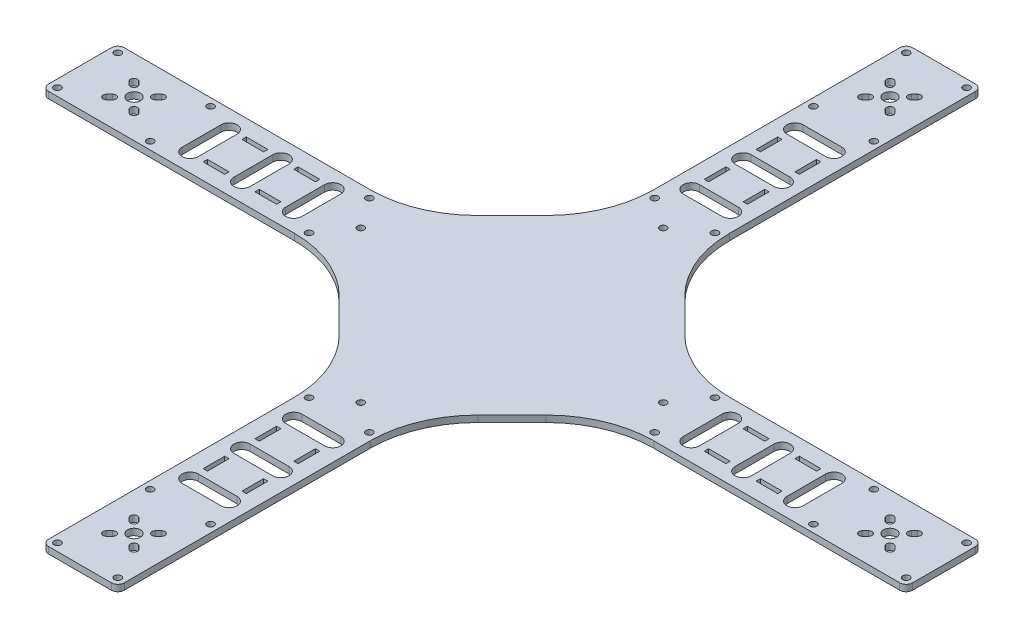
from build123d import *

# Parameters (mm, degrees)
SKETCH_196_R    = 1.6
SKETCH_196_W    = 10
SKETCH_196_H    = 2
SKETCH_196_R_2  = 3
SKETCH_196_W_2  = 2
SKETCH_196_H_2  = 10
EXTRUDE_1_DEPTH = 3
FILLET_3_R      = 3


with BuildPart() as part:
    # Sketch 196 → 凸台-拉伸1 (new body)
    with BuildSketch(Plane(origin=(0, 0, 0), x_dir=(1, 0, 0), z_dir=(0, 1, 0))):
        with BuildLine():
            Line((17.5, 25), (-17.5, 25))
            Line((-17.5, 25), (-17.5, -91.789321881))
            ThreePointArc((-17.5, -91.789321881), (-21.306023374, -110.9234935), (-32.144660941, -127.144660941))
            Line((-32.144660941, -127.144660941), (-47.855339059, -142.855339059))
            ThreePointArc((-47.855339059, -142.855339059), (-64.0765065, -153.693976626), (-83.210678119, -157.5))
            Line((-83.210678119, -157.5), (-200, -157.5))
            Line((-200, -157.5), (-200, -192.5))
            Line((-200, -192.5), (-83.210678119, -192.5))
            ThreePointArc((-83.210678119, -192.5), (-64.0765065, -196.306023374), (-47.855339059, -207.144660941))
            Line((-47.855339059, -207.144660941), (-32.144660941, -222.855339059))
            ThreePointArc((-32.144660941, -222.855339059), (-21.306023374, -239.0765065), (-17.5, -258.210678119))
            Line((-17.5, -258.210678119), (-17.5, -375))
            Line((-17.5, -375), (17.5, -375))
            Line((17.5, -375), (17.5, -258.210678119))
            ThreePointArc((17.5, -258.210678119), (21.306023374, -239.0765065), (32.144660941, -222.855339059))
            Line((32.144660941, -222.855339059), (47.855339059, -207.144660941))
            ThreePointArc((47.855339059, -207.144660941), (64.0765065, -196.306023374), (83.210678119, -192.5))
            Line((83.210678119, -192.5), (200, -192.5))
            Line((200, -192.5), (200, -157.5))
            Line((200, -157.5), (83.210678119, -157.5))
            ThreePointArc((83.210678119, -157.5), (64.0765065, -153.693976626), (47.855339059, -142.855339059))
            Line((47.855339059, -142.855339059), (32.144660941, -127.144660941))
            ThreePointArc((32.144660941, -127.144660941), (21.306023374, -110.9234935), (17.5, -91.789321881))
            Line((17.5, -91.789321881), (17.5, 25))
        make_face()
        with Locations(Location((-196.464466094, -188.964466094, 0), (0, 0, 270))):
            Circle(SKETCH_196_R, mode=Mode.SUBTRACT)
        with BuildLine():
            ThreePointArc((-181.081118318, -178.818376618), (-178.818376618, -178.818376618), (-178.818376618, -181.081118318))
            Line((-178.818376618, -181.081118318), (-180.232590181, -182.495331881))
            ThreePointArc((-180.232590181, -182.495331881), (-182.495331881, -182.495331881), (-182.495331881, -180.232590181))
            Line((-182.495331881, -180.232590181), (-181.081118318, -178.818376618))
        make_face(mode=Mode.SUBTRACT)
        with Locations(Location((-153.535533906, -188.964466094, 0), (0, 0, 270))):
            Circle(SKETCH_196_R, mode=Mode.SUBTRACT)
        with BuildLine():
            ThreePointArc((-171.181623382, -181.081118318), (-171.181623382, -178.818376618), (-168.918881682, -178.818376618))
            Line((-168.918881682, -178.818376618), (-167.504668119, -180.232590181))
            ThreePointArc((-167.504668119, -180.232590181), (-167.504668119, -182.495331881), (-169.767409819, -182.495331881))
            Line((-169.767409819, -182.495331881), (-171.181623382, -181.081118318))
        make_face(mode=Mode.SUBTRACT)
        with Locations((-128, -184)):
            Rectangle(SKETCH_196_W, SKETCH_196_H, mode=Mode.SUBTRACT)
        with Locations((-104, -184)):
            Rectangle(SKETCH_196_W, SKETCH_196_H, mode=Mode.SUBTRACT)
        with Locations(Location((-80, -188.964466094, 0), (0, 0, 270))):
            Circle(SKETCH_196_R, mode=Mode.SUBTRACT)
        with Locations(Location((-175, -175, 0), (0, 0, 270))):
            Circle(SKETCH_196_R_2, mode=Mode.SUBTRACT)
        with BuildLine():
            ThreePointArc((-178.818376618, -168.918881682), (-178.818376618, -171.181623382), (-181.081118318, -171.181623382))
            Line((-181.081118318, -171.181623382), (-182.495331881, -169.767409819))
            ThreePointArc((-182.495331881, -169.767409819), (-182.495331881, -167.504668119), (-180.232590181, -167.504668119))
            Line((-180.232590181, -167.504668119), (-178.818376618, -168.918881682))
        make_face(mode=Mode.SUBTRACT)
        with BuildLine():
            ThreePointArc((-168.918881682, -171.181623382), (-171.181623382, -171.181623382), (-171.181623382, -168.918881682))
            Line((-171.181623382, -168.918881682), (-169.767409819, -167.504668119))
            ThreePointArc((-169.767409819, -167.504668119), (-167.504668119, -167.504668119), (-167.504668119, -169.767409819))
            Line((-167.504668119, -169.767409819), (-168.918881682, -171.181623382))
        make_face(mode=Mode.SUBTRACT)
        with Locations(Location((-196.464466094, -161.035533906, 0), (0, 0, 270))):
            Circle(SKETCH_196_R, mode=Mode.SUBTRACT)
        with Locations(Location((-153.535533906, -161.035533906, 0), (0, 0, 270))):
            Circle(SKETCH_196_R, mode=Mode.SUBTRACT)
        with BuildLine():
            ThreePointArc((-143.75, -166), (-140, -162.25), (-136.25, -166))
            Line((-136.25, -166), (-136.25, -184))
            ThreePointArc((-136.25, -184), (-140, -187.75), (-143.75, -184))
            Line((-143.75, -184), (-143.75, -175))
            Line((-143.75, -175), (-143.75, -166))
        make_face(mode=Mode.SUBTRACT)
        Polygon((-133, -167), (-133, -166), (-133, -165), (-123, -165), (-123, -166), (-123, -167), align=None, mode=Mode.SUBTRACT)
        with BuildLine():
            Line((-119.75, -184), (-119.75, -166))
            ThreePointArc((-119.75, -166), (-116, -162.25), (-112.25, -166))
            Line((-112.25, -166), (-112.25, -184))
            ThreePointArc((-112.25, -184), (-116, -187.75), (-119.75, -184))
        make_face(mode=Mode.SUBTRACT)
        with Locations((-104, -166)):
            Rectangle(SKETCH_196_W, SKETCH_196_H, mode=Mode.SUBTRACT)
        with BuildLine():
            ThreePointArc((-88.25, -184), (-92, -187.75), (-95.75, -184))
            Line((-95.75, -184), (-95.75, -166))
            ThreePointArc((-95.75, -166), (-92, -162.25), (-88.25, -166))
            Line((-88.25, -166), (-88.25, -184))
        make_face(mode=Mode.SUBTRACT)
        with Locations(Location((-70, -175, 0), (0, 0, 270))):
            Circle(SKETCH_196_R, mode=Mode.SUBTRACT)
        with Locations(Location((-80, -161.035533906, 0), (0, 0, 270))):
            Circle(SKETCH_196_R, mode=Mode.SUBTRACT)
        with Locations(Location((0, -245, 0), (0, 0, 270))):
            Circle(SKETCH_196_R, mode=Mode.SUBTRACT)
        with Locations(Location((80, -188.964466094, 0), (0, 0, 270))):
            Circle(SKETCH_196_R, mode=Mode.SUBTRACT)
        with Locations((104, -184)):
            Rectangle(SKETCH_196_W, SKETCH_196_H, mode=Mode.SUBTRACT)
        Polygon((123, -183), (133, -183), (133, -184), (133, -185), (123, -185), (123, -184), align=None, mode=Mode.SUBTRACT)
        with Locations(Location((153.535533906, -188.964466094, 0), (0, 0, 270))):
            Circle(SKETCH_196_R, mode=Mode.SUBTRACT)
        with BuildLine():
            ThreePointArc((168.918881682, -178.818376618), (171.181623382, -178.818376618), (171.181623382, -181.081118318))
            Line((171.181623382, -181.081118318), (169.767409819, -182.495331881))
            ThreePointArc((169.767409819, -182.495331881), (167.504668119, -182.495331881), (167.504668119, -180.232590181))
            Line((167.504668119, -180.232590181), (168.918881682, -178.818376618))
        make_face(mode=Mode.SUBTRACT)
        with Locations(Location((196.464466094, -188.964466094, 0), (0, 0, 270))):
            Circle(SKETCH_196_R, mode=Mode.SUBTRACT)
        with BuildLine():
            ThreePointArc((178.818376618, -181.081118318), (178.818376618, -178.818376618), (181.081118318, -178.818376618))
            Line((181.081118318, -178.818376618), (182.495331881, -180.232590181))
            ThreePointArc((182.495331881, -180.232590181), (182.495331881, -182.495331881), (180.232590181, -182.495331881))
            Line((180.232590181, -182.495331881), (178.818376618, -181.081118318))
        make_face(mode=Mode.SUBTRACT)
        with Locations(Location((70, -175, 0), (0, 0, 270))):
            Circle(SKETCH_196_R, mode=Mode.SUBTRACT)
        with BuildLine():
            ThreePointArc((88.25, -166), (92, -162.25), (95.75, -166))
            Line((95.75, -166), (95.75, -184))
            ThreePointArc((95.75, -184), (92, -187.75), (88.25, -184))
            Line((88.25, -184), (88.25, -166))
        make_face(mode=Mode.SUBTRACT)
        with Locations(Location((80, -161.035533906, 0), (0, 0, 270))):
            Circle(SKETCH_196_R, mode=Mode.SUBTRACT)
        with BuildLine():
            Line((119.75, -166), (119.75, -184))
            ThreePointArc((119.75, -184), (116, -187.75), (112.25, -184))
            Line((112.25, -184), (112.25, -166))
            ThreePointArc((112.25, -166), (116, -162.25), (119.75, -166))
        make_face(mode=Mode.SUBTRACT)
        with Locations((104, -166)):
            Rectangle(SKETCH_196_W, SKETCH_196_H, mode=Mode.SUBTRACT)
        with BuildLine():
            ThreePointArc((143.75, -184), (140, -187.75), (136.25, -184))
            Line((136.25, -184), (136.25, -166))
            ThreePointArc((136.25, -166), (140, -162.25), (143.75, -166))
            Line((143.75, -166), (143.75, -175))
            Line((143.75, -175), (143.75, -184))
        make_face(mode=Mode.SUBTRACT)
        with Locations((128, -166)):
            Rectangle(SKETCH_196_W, SKETCH_196_H, mode=Mode.SUBTRACT)
        with BuildLine():
            ThreePointArc((171.181623382, -168.918881682), (171.181623382, -171.181623382), (168.918881682, -171.181623382))
            Line((168.918881682, -171.181623382), (167.504668119, -169.767409819))
            ThreePointArc((167.504668119, -169.767409819), (167.504668119, -167.504668119), (169.767409819, -167.504668119))
            Line((169.767409819, -167.504668119), (171.181623382, -168.918881682))
        make_face(mode=Mode.SUBTRACT)
        with Locations(Location((175, -175, 0), (0, 0, 270))):
            Circle(SKETCH_196_R_2, mode=Mode.SUBTRACT)
        with BuildLine():
            ThreePointArc((181.081118318, -171.181623382), (178.818376618, -171.181623382), (178.818376618, -168.918881682))
            Line((178.818376618, -168.918881682), (180.232590181, -167.504668119))
            ThreePointArc((180.232590181, -167.504668119), (182.495331881, -167.504668119), (182.495331881, -169.767409819))
            Line((182.495331881, -169.767409819), (181.081118318, -171.181623382))
        make_face(mode=Mode.SUBTRACT)
        with Locations(Location((153.535533906, -161.035533906, 0), (0, 0, 270))):
            Circle(SKETCH_196_R, mode=Mode.SUBTRACT)
        with Locations(Location((196.464466094, -161.035533906, 0), (0, 0, 270))):
            Circle(SKETCH_196_R, mode=Mode.SUBTRACT)
        with Locations(Location((0, -105, 0), (0, 0, 270))):
            Circle(SKETCH_196_R, mode=Mode.SUBTRACT)
        with Locations(Location((-13.964466094, -95, 0), (0, 0, 270))):
            Circle(SKETCH_196_R, mode=Mode.SUBTRACT)
        with BuildLine():
            ThreePointArc((-9, -86.75), (-12.75, -83), (-9, -79.25))
            Line((-9, -79.25), (9, -79.25))
            ThreePointArc((9, -79.25), (12.75, -83), (9, -86.75))
            Line((9, -86.75), (-9, -86.75))
        make_face(mode=Mode.SUBTRACT)
        with Locations((-9, -71)):
            Rectangle(SKETCH_196_W_2, SKETCH_196_H_2, mode=Mode.SUBTRACT)
        with BuildLine():
            ThreePointArc((-9, -62.75), (-12.75, -59), (-9, -55.25))
            Line((-9, -55.25), (9, -55.25))
            ThreePointArc((9, -55.25), (12.75, -59), (9, -62.75))
            Line((9, -62.75), (-9, -62.75))
        make_face(mode=Mode.SUBTRACT)
        with Locations((-9, -47)):
            Rectangle(SKETCH_196_W_2, SKETCH_196_H_2, mode=Mode.SUBTRACT)
        with BuildLine():
            ThreePointArc((9, -31.25), (12.75, -35), (9, -38.75))
            Line((9, -38.75), (-9, -38.75))
            ThreePointArc((-9, -38.75), (-12.75, -35), (-9, -31.25))
            Line((-9, -31.25), (0, -31.25))
            Line((0, -31.25), (9, -31.25))
        make_face(mode=Mode.SUBTRACT)
        with Locations(Location((-13.964466094, -21.464466094, 0), (0, 0, 270))):
            Circle(SKETCH_196_R, mode=Mode.SUBTRACT)
        with BuildLine():
            ThreePointArc((-6.081118318, -3.818376618), (-3.818376618, -3.818376618), (-3.818376618, -6.081118318))
            Line((-3.818376618, -6.081118318), (-5.232590181, -7.495331881))
            ThreePointArc((-5.232590181, -7.495331881), (-7.495331881, -7.495331881), (-7.495331881, -5.232590181))
            Line((-7.495331881, -5.232590181), (-6.081118318, -3.818376618))
        make_face(mode=Mode.SUBTRACT)
        with Locations(Location((0, 0, 0), (0, 0, 270))):
            Circle(SKETCH_196_R_2, mode=Mode.SUBTRACT)
        with BuildLine():
            ThreePointArc((-3.818376618, 6.081118318), (-3.818376618, 3.818376618), (-6.081118318, 3.818376618))
            Line((-6.081118318, 3.818376618), (-7.495331881, 5.232590181))
            ThreePointArc((-7.495331881, 5.232590181), (-7.495331881, 7.495331881), (-5.232590181, 7.495331881))
            Line((-5.232590181, 7.495331881), (-3.818376618, 6.081118318))
        make_face(mode=Mode.SUBTRACT)
        with Locations(Location((-13.964466094, 21.464466094, 0), (0, 0, 270))):
            Circle(SKETCH_196_R, mode=Mode.SUBTRACT)
        with Locations(Location((13.964466094, -95, 0), (0, 0, 270))):
            Circle(SKETCH_196_R, mode=Mode.SUBTRACT)
        with Locations((9, -71)):
            Rectangle(SKETCH_196_W_2, SKETCH_196_H_2, mode=Mode.SUBTRACT)
        Polygon((10, -52), (9, -52), (8, -52), (8, -42), (9, -42), (10, -42), align=None, mode=Mode.SUBTRACT)
        with Locations(Location((13.964466094, -21.464466094, 0), (0, 0, 270))):
            Circle(SKETCH_196_R, mode=Mode.SUBTRACT)
        with BuildLine():
            ThreePointArc((3.818376618, -6.081118318), (3.818376618, -3.818376618), (6.081118318, -3.818376618))
            Line((6.081118318, -3.818376618), (7.495331881, -5.232590181))
            ThreePointArc((7.495331881, -5.232590181), (7.495331881, -7.495331881), (5.232590181, -7.495331881))
            Line((5.232590181, -7.495331881), (3.818376618, -6.081118318))
        make_face(mode=Mode.SUBTRACT)
        with BuildLine():
            ThreePointArc((6.081118318, 3.818376618), (3.818376618, 3.818376618), (3.818376618, 6.081118318))
            Line((3.818376618, 6.081118318), (5.232590181, 7.495331881))
            ThreePointArc((5.232590181, 7.495331881), (7.495331881, 7.495331881), (7.495331881, 5.232590181))
            Line((7.495331881, 5.232590181), (6.081118318, 3.818376618))
        make_face(mode=Mode.SUBTRACT)
        with Locations(Location((13.964466094, 21.464466094, 0), (0, 0, 270))):
            Circle(SKETCH_196_R, mode=Mode.SUBTRACT)
        with Locations(Location((-13.964466094, -371.464466094, 0), (0, 0, 270))):
            Circle(SKETCH_196_R, mode=Mode.SUBTRACT)
        with BuildLine():
            ThreePointArc((-6.081118318, -353.818376618), (-3.818376618, -353.818376618), (-3.818376618, -356.081118318))
            Line((-3.818376618, -356.081118318), (-5.232590181, -357.495331881))
            ThreePointArc((-5.232590181, -357.495331881), (-7.495331881, -357.495331881), (-7.495331881, -355.232590181))
            Line((-7.495331881, -355.232590181), (-6.081118318, -353.818376618))
        make_face(mode=Mode.SUBTRACT)
        with BuildLine():
            ThreePointArc((-3.818376618, -343.918881682), (-3.818376618, -346.181623382), (-6.081118318, -346.181623382))
            Line((-6.081118318, -346.181623382), (-7.495331881, -344.767409819))
            ThreePointArc((-7.495331881, -344.767409819), (-7.495331881, -342.504668119), (-5.232590181, -342.504668119))
            Line((-5.232590181, -342.504668119), (-3.818376618, -343.918881682))
        make_face(mode=Mode.SUBTRACT)
        with Locations(Location((0, -350, 0), (0, 0, 270))):
            Circle(SKETCH_196_R_2, mode=Mode.SUBTRACT)
        with Locations(Location((-13.964466094, -328.535533906, 0), (0, 0, 270))):
            Circle(SKETCH_196_R, mode=Mode.SUBTRACT)
        with BuildLine():
            ThreePointArc((3.818376618, -356.081118318), (3.818376618, -353.818376618), (6.081118318, -353.818376618))
            Line((6.081118318, -353.818376618), (7.495331881, -355.232590181))
            ThreePointArc((7.495331881, -355.232590181), (7.495331881, -357.495331881), (5.232590181, -357.495331881))
            Line((5.232590181, -357.495331881), (3.818376618, -356.081118318))
        make_face(mode=Mode.SUBTRACT)
        with BuildLine():
            ThreePointArc((6.081118318, -346.181623382), (3.818376618, -346.181623382), (3.818376618, -343.918881682))
            Line((3.818376618, -343.918881682), (5.232590181, -342.504668119))
            ThreePointArc((5.232590181, -342.504668119), (7.495331881, -342.504668119), (7.495331881, -344.767409819))
            Line((7.495331881, -344.767409819), (6.081118318, -346.181623382))
        make_face(mode=Mode.SUBTRACT)
        with Locations(Location((13.964466094, -371.464466094, 0), (0, 0, 270))):
            Circle(SKETCH_196_R, mode=Mode.SUBTRACT)
        with BuildLine():
            ThreePointArc((-9, -318.75), (-12.75, -315), (-9, -311.25))
            Line((-9, -311.25), (9, -311.25))
            ThreePointArc((9, -311.25), (12.75, -315), (9, -318.75))
            Line((9, -318.75), (0, -318.75))
            Line((0, -318.75), (-9, -318.75))
        make_face(mode=Mode.SUBTRACT)
        with Locations(Location((13.964466094, -328.535533906, 0), (0, 0, 270))):
            Circle(SKETCH_196_R, mode=Mode.SUBTRACT)
        Polygon((-8, -308), (-9, -308), (-10, -308), (-10, -298), (-9, -298), (-8, -298), align=None, mode=Mode.SUBTRACT)
        with Locations((-9, -279)):
            Rectangle(SKETCH_196_W_2, SKETCH_196_H_2, mode=Mode.SUBTRACT)
        with Locations(Location((-13.964466094, -255, 0), (0, 0, 270))):
            Circle(SKETCH_196_R, mode=Mode.SUBTRACT)
        with BuildLine():
            Line((9, -294.75), (-9, -294.75))
            ThreePointArc((-9, -294.75), (-12.75, -291), (-9, -287.25))
            Line((-9, -287.25), (9, -287.25))
            ThreePointArc((9, -287.25), (12.75, -291), (9, -294.75))
        make_face(mode=Mode.SUBTRACT)
        with Locations((9, -303)):
            Rectangle(SKETCH_196_W_2, SKETCH_196_H_2, mode=Mode.SUBTRACT)
        with BuildLine():
            ThreePointArc((9, -263.25), (12.75, -267), (9, -270.75))
            Line((9, -270.75), (-9, -270.75))
            ThreePointArc((-9, -270.75), (-12.75, -267), (-9, -263.25))
            Line((-9, -263.25), (9, -263.25))
        make_face(mode=Mode.SUBTRACT)
        with Locations((9, -279)):
            Rectangle(SKETCH_196_W_2, SKETCH_196_H_2, mode=Mode.SUBTRACT)
        with Locations(Location((13.964466094, -255, 0), (0, 0, 270))):
            Circle(SKETCH_196_R, mode=Mode.SUBTRACT)
    extrude(amount=EXTRUDE_1_DEPTH)

    # 圆角3
    fillet_3_edges = [part.edges().sort_by_distance(p)[0] for p in [
        (-200, 1.5, 192.5),
        (-200, 1.5, 157.5),
        (-17.5, 1.5, -25),
        (17.5, 1.5, -25),
        (200, 1.5, 157.5),
        (200, 1.5, 192.5),
        (17.5, 1.5, 375),
        (-17.5, 1.5, 375),
    ]]
    fillet(fillet_3_edges, radius=FILLET_3_R)


solid = part.part
